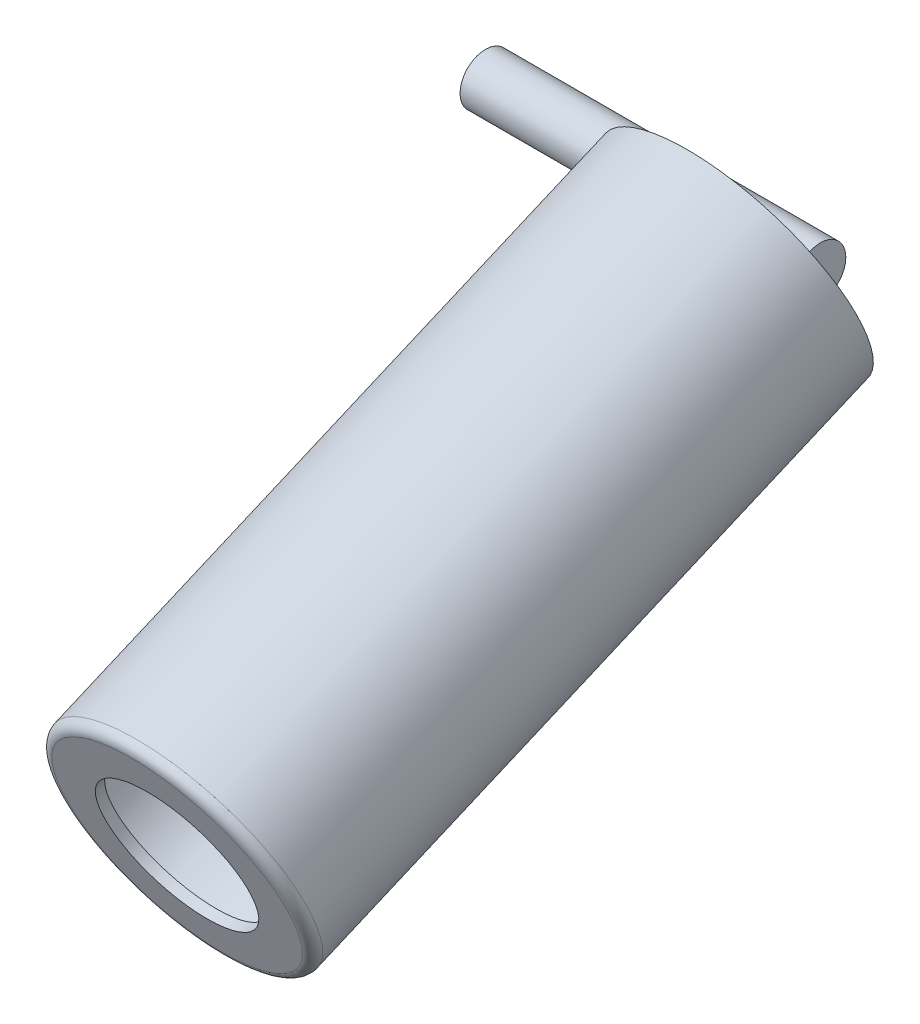
from build123d import *

# Parameters (mm, degrees)
CROQUIS2_R              = 25.000000002
SALIENTE_EXTRUIR1_DEPTH = 200
SALIENTE_EXTRUIR3_START = -550
CROQUIS5_R              = 125
CROQUIS5_R_2            = 110
SALIENTE_EXTRUIR3_DEPTH = 600
CROQUIS6_R              = 125
CROQUIS6_R_2            = 75
SALIENTE_EXTRUIR4_DEPTH = 10
REDONDEO1_R             = 10
SALIENTE_EXTRUIR5_START = -10
CROQUIS7_R              = 125
SALIENTE_EXTRUIR5_DEPTH = 10
SALIENTE_EXTRUIR7_DEPTH = 130


with BuildPart() as part:
    # Croquis2 → Saliente-Extruir1 (new body)
    with BuildSketch(Plane.ZY.offset(995.514439922)):
        with Locations((1824.824247225, -360.492761656)):
            Circle(CROQUIS2_R)
    extrude(amount=-SALIENTE_EXTRUIR1_DEPTH)

    # Croquis5 → Saliente-Extruir3 (add)
    with BuildSketch(Plane(origin=(0, -1175.698746169, 2749.222800852), x_dir=(1, 0, 0), z_dir=(0, -0.39320162856731994, 0.919452271350725)).offset(SALIENTE_EXTRUIR3_START)):
        with Locations(Location((-728.864439922, 386.067977351, 0), (0, 0, 270))):
            Circle(CROQUIS5_R)
        with Locations(Location((-728.864439922, 386.067977351, 0), (0, 0, 270))):
            Circle(CROQUIS5_R_2, mode=Mode.SUBTRACT)
    extrude(amount=-SALIENTE_EXTRUIR3_DEPTH)

    # Croquis6 → Saliente-Extruir4 (add)
    with BuildSketch(Plane(origin=(0, -959.437850457, 2243.524051609), x_dir=(1, 0, 0), z_dir=(0, -0.39320162856732, 0.919452271350725))):
        with Locations(Location((-728.864439922, 386.067977351, 0), (0, 0, 270))):
            Circle(CROQUIS6_R)
        with Locations(Location((-728.864439922, 386.067977351, 0), (0, 0, 270))):
            Circle(CROQUIS6_R_2, mode=Mode.SUBTRACT)
    extrude(amount=-SALIENTE_EXTRUIR4_DEPTH)

    # Redondeo1
    redondeo1_edges = [part.edges().sort_by_distance(p)[0] for p in [
        (-728.864439922, -489.535237867, 2444.476812612),
    ]]
    fillet(redondeo1_edges, radius=REDONDEO1_R)

    # Croquis7 → Saliente-Extruir5 (add)
    with BuildSketch(Plane(origin=(0, -723.516873317, 1691.852688798), x_dir=(-1, 0, 0), z_dir=(0, 0.39320162856732, -0.919452271350725)).offset(SALIENTE_EXTRUIR5_START)):
        with Locations(Location((728.864439922, 386.067977351, 0), (0, 0, 270))):
            Circle(CROQUIS7_R)
    extrude(amount=SALIENTE_EXTRUIR5_DEPTH)

    # Croquis11 → Saliente-Extruir7 (add)
    with BuildSketch(Plane(origin=(-795.514439922, 0, 0), x_dir=(0, 0, -1), z_dir=(1, 0, 0))):
        with BuildLine():
            Line((-1850.902577314, -351.598827639), (-1842.90075375, -343.22313769))
            ThreePointArc((-1842.90075375, -343.22313769), (-1801.83794044, -350.662720941), (-1824.824247225, -385.492761657))
            Line((-1824.824247225, -385.492761657), (-1836.407915144, -385.492761657))
            Line((-1836.407915144, -385.492761657), (-1850.902577314, -351.598827639))
        make_face()
    extrude(amount=SALIENTE_EXTRUIR7_DEPTH)


solid = part.part
